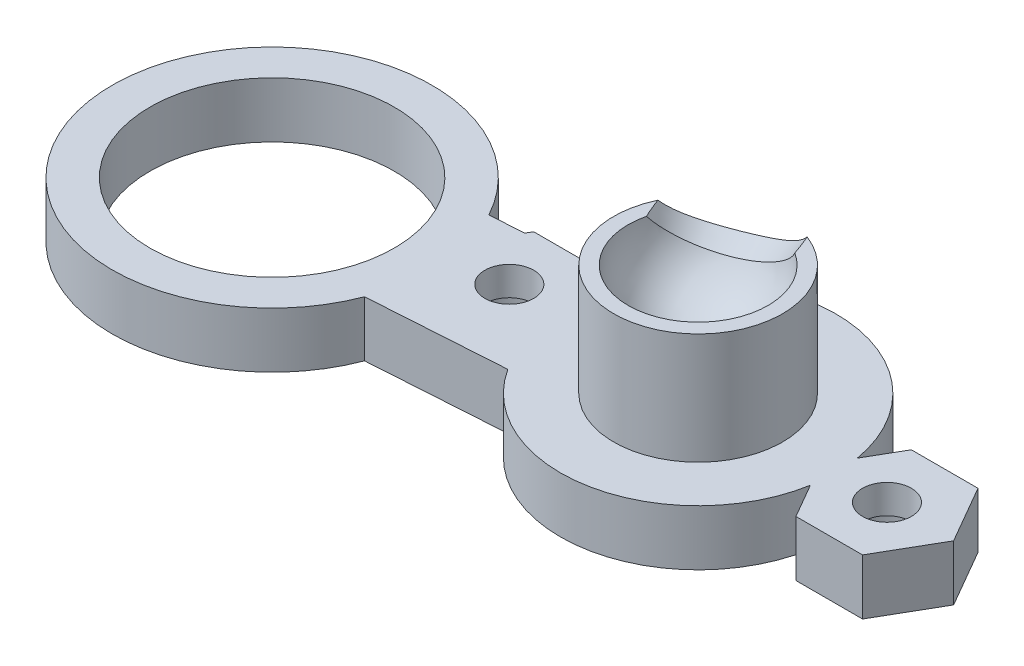
from build123d import *

# Parameters (mm, degrees)
RETAINER_FEATURE_1_PROFILE_R  = 3.8
RETAINER_FEATURE_1_DEPTH      = 5.02
RETAINER_FEATURE_2_PROFILE_R  = 6.2
RETAINER_FEATURE_2_DEPTH      = 2.5
RETAINER_FEATURE_5_DEPTH      = 2.5
RETAINER_FEATURE_8_DEPTH      = 2.5
RETAINER_FEATURE_12_DEPTH     = 2.5
RETAINER_FEATURE_13_PROFILE_R = 7.2
RETAINER_FEATURE_13_DEPTH     = 2.5
RETAINER_FEATURE_14_PROFILE_R = 5.5
RETAINER_FEATURE_14_DEPTH     = 2.7
RETAINER_FEATURE_15_PROFILE_R = 1.1
RETAINER_FEATURE_15_DEPTH     = 3.75
RETAINER_FEATURE_16_PROFILE_R = 2.1
RETAINER_FEATURE_16_DEPTH     = 1.45
RETAINER_FEATURE_17_PROFILE_R = 1.1
RETAINER_FEATURE_17_DEPTH     = 3.75
RETAINER_FEATURE_18_PROFILE_R = 2.1
RETAINER_FEATURE_18_DEPTH     = 1.45


with BuildPart() as part:
    # Retainer Feature 1 profile → Retainer Feature 1 (new body)
    with BuildSketch(Plane(origin=(0, -101, 0), x_dir=(-1, 0, 0), z_dir=(0, -1, 0))):
        with Locations(Location((56.291651246, -30, 0), (0, 0, 90))):
            Circle(RETAINER_FEATURE_1_PROFILE_R)
    extrude(amount=RETAINER_FEATURE_1_DEPTH)

    # Retainer Feature 2 profile → Retainer Feature 2 (add)
    with BuildSketch(Plane(origin=(0, -106, 0), x_dir=(-1, 0, 0), z_dir=(0, -1, 0))):
        with Locations(Location((56.291651246, -30, 0), (0, 0, 90))):
            Circle(RETAINER_FEATURE_2_PROFILE_R)
    extrude(amount=RETAINER_FEATURE_2_DEPTH)

    # Middle Right Floating Compression Ball R → Retainer Feature 5 (add)
    with BuildSketch(Plane(origin=(0, -106, 0), x_dir=(-1, 0, 0), z_dir=(0, -1, 0))):
        Polygon((44.791651246, -30), (46.291651246, -32.598076211), (49.291651246, -32.598076211), (50.791651246, -30), (49.291651246, -27.401923789), (46.291651246, -27.401923789), align=None)
    extrude(amount=RETAINER_FEATURE_5_DEPTH)

    # Middle Right Floating Compression Ba 2 → Retainer Feature 8 (add)
    with BuildSketch(Plane(origin=(0, -106, 0), x_dir=(-1, 0, 0), z_dir=(0, -1, 0))):
        Polygon((61.791651246, -30), (63.291651246, -32.598076211), (66.291651246, -32.598076211), (67.791651246, -30), (66.291651246, -27.401923789), (63.291651246, -27.401923789), align=None)
    extrude(amount=RETAINER_FEATURE_8_DEPTH)

    # Retainer Feature 9 profile → Retainer Feature 9 (revolve, cut)
    with BuildSketch(Plane(origin=(0, -101, 0), x_dir=(-1, 0, 0), z_dir=(0, -1, 0))):
        with BuildLine():
            Line((56.291651246, -33.15), (56.291651246, -26.85))
            ThreePointArc((56.291651246, -26.85), (53.141651246, -30), (56.291651246, -33.15))
        make_face()
    revolve(axis=Axis((-56.291651246, -101, 20), (0, 0, 1)), mode=Mode.SUBTRACT)

    # Middle Right Floating Compression Ba 3 → Retainer Feature 12 (add)
    with BuildSketch(Plane(origin=(0, -106, 0), x_dir=(-1, 0, 0), z_dir=(0, -1, 0))):
        Polygon((56.095916768, -32.993607859), (74.095916768, -34.170522395), (74.487385724, -28.183306677), (56.487385724, -27.006392141), align=None)
    extrude(amount=RETAINER_FEATURE_12_DEPTH)

    # Retainer Feature 13 profile → Retainer Feature 13 (add)
    with BuildSketch(Plane(origin=(0, -106, 0), x_dir=(-1, 0, 0), z_dir=(0, -1, 0))):
        with Locations((74.291651246, -31.176914536)):
            Circle(RETAINER_FEATURE_13_PROFILE_R)
    extrude(amount=RETAINER_FEATURE_13_DEPTH)

    # Retainer Feature 14 profile → Retainer Feature 14 (cut)
    with BuildSketch(Plane(origin=(0, -105.9, 0), x_dir=(-1, 0, 0), z_dir=(0, -1, 0))):
        with Locations(Location((74.291651246, -31.176914536, 0), (0, 0, 270))):
            Circle(RETAINER_FEATURE_14_PROFILE_R)
    extrude(amount=RETAINER_FEATURE_14_DEPTH, mode=Mode.SUBTRACT)

    # Retainer Feature 15 profile → Retainer Feature 15 (cut)
    with BuildSketch(Plane(origin=(0, -105, 0), x_dir=(-1, 0, 0), z_dir=(0, -1, 0))):
        with Locations(Location((47.791651246, -30, 0), (0, 0, 90))):
            Circle(RETAINER_FEATURE_15_PROFILE_R)
    extrude(amount=RETAINER_FEATURE_15_DEPTH, mode=Mode.SUBTRACT)

    # Retainer Feature 16 profile → Retainer Feature 16 (cut)
    with BuildSketch(Plane(origin=(0, -107.3, 0), x_dir=(-1, 0, 0), z_dir=(0, -1, 0))):
        with Locations(Location((47.791651246, -30, 0), (0, 0, 90))):
            Circle(RETAINER_FEATURE_16_PROFILE_R)
    extrude(amount=RETAINER_FEATURE_16_DEPTH, mode=Mode.SUBTRACT)

    # Retainer Feature 17 profile → Retainer Feature 17 (cut)
    with BuildSketch(Plane(origin=(0, -105, 0), x_dir=(-1, 0, 0), z_dir=(0, -1, 0))):
        with Locations(Location((64.791651246, -30, 0), (0, 0, 90))):
            Circle(RETAINER_FEATURE_17_PROFILE_R)
    extrude(amount=RETAINER_FEATURE_17_DEPTH, mode=Mode.SUBTRACT)

    # Retainer Feature 18 profile → Retainer Feature 18 (cut)
    with BuildSketch(Plane(origin=(0, -107.3, 0), x_dir=(-1, 0, 0), z_dir=(0, -1, 0))):
        with Locations(Location((64.791651246, -30, 0), (0, 0, 90))):
            Circle(RETAINER_FEATURE_18_PROFILE_R)
    extrude(amount=RETAINER_FEATURE_18_DEPTH, mode=Mode.SUBTRACT)

    # Articulation Throat Sketch → Articulation Throat (revolve, cut)
    with BuildSketch(Plane(origin=(-75.19414337, -14.119516346, 20.509419779), x_dir=(-0.2544785459472912, -0.04778449262394895, -0.9658971539026421), z_dir=(0.9493062747008634, 0.17825517869277502, -0.2589260282064664))):
        Polygon((-9.825663304, -88.876600419), (-8.475389129, -90.738524062), (14.088996194, -82.675837476), (8.793573125, -75.373858667), align=None)
    revolve(axis=Axis((-53.148124615, -106.383086561, 37.819246728), (-0.3143526631246646, 0.5383086561091633, -0.781924672807028)), mode=Mode.SUBTRACT)


solid = part.part
